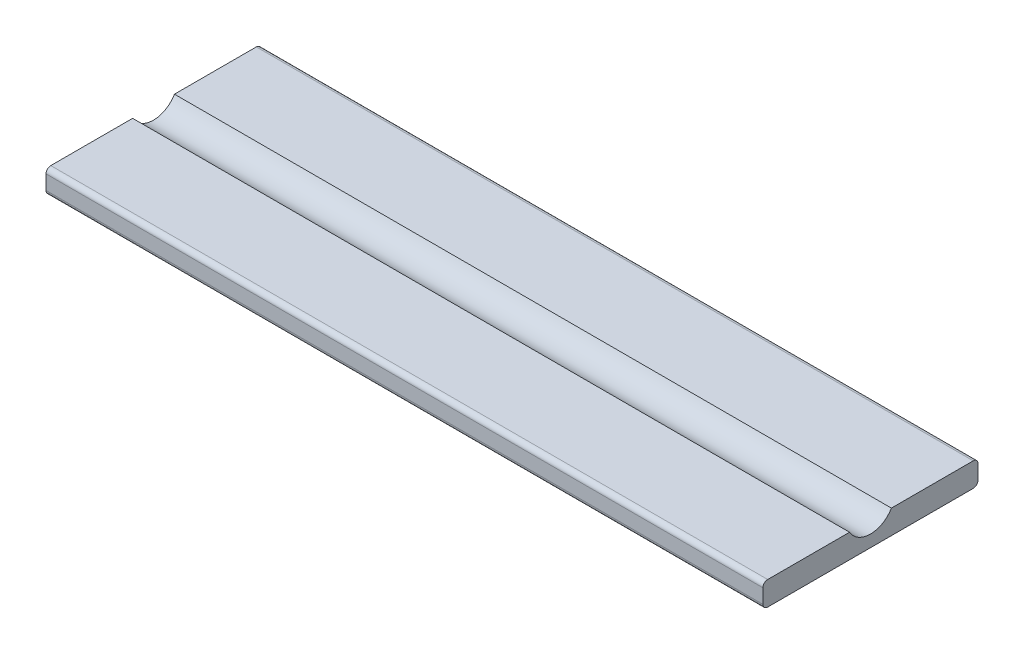
from build123d import *

# Parameters (mm, degrees)
EXTRUDE1_DEPTH = 47.625
FILLET1_R      = 0.635


with BuildPart() as part:
    # Sketch2 → Extrude1 (new, symmetric)
    with BuildSketch(Plane(origin=(0, 0, 0), x_dir=(0, 0, -1), z_dir=(1, 0, 0))):
        with BuildLine():
            Line((-14.2875, 3.175), (-2.778125, 3.175))
            ThreePointArc((-2.778125, 3.175), (0, 1.5748), (2.778125, 3.175))
            Line((2.778125, 3.175), (14.2875, 3.175))
            Line((14.2875, 3.175), (14.2875, 0))
            Line((14.2875, 0), (-14.2875, 0))
            Line((-14.2875, 0), (-14.2875, 3.175))
        make_face()
    extrude(amount=EXTRUDE1_DEPTH, both=True)

    # Fillet1
    fillet1_edges = [part.edges().sort_by_distance(p)[0] for p in [
        (0, 3.175, 14.2875),
        (0, 3.175, -14.2875),
        (0, 0, -14.2875),
        (0, 0, 14.2875),
    ]]
    fillet(fillet1_edges, radius=FILLET1_R)


solid = part.part
